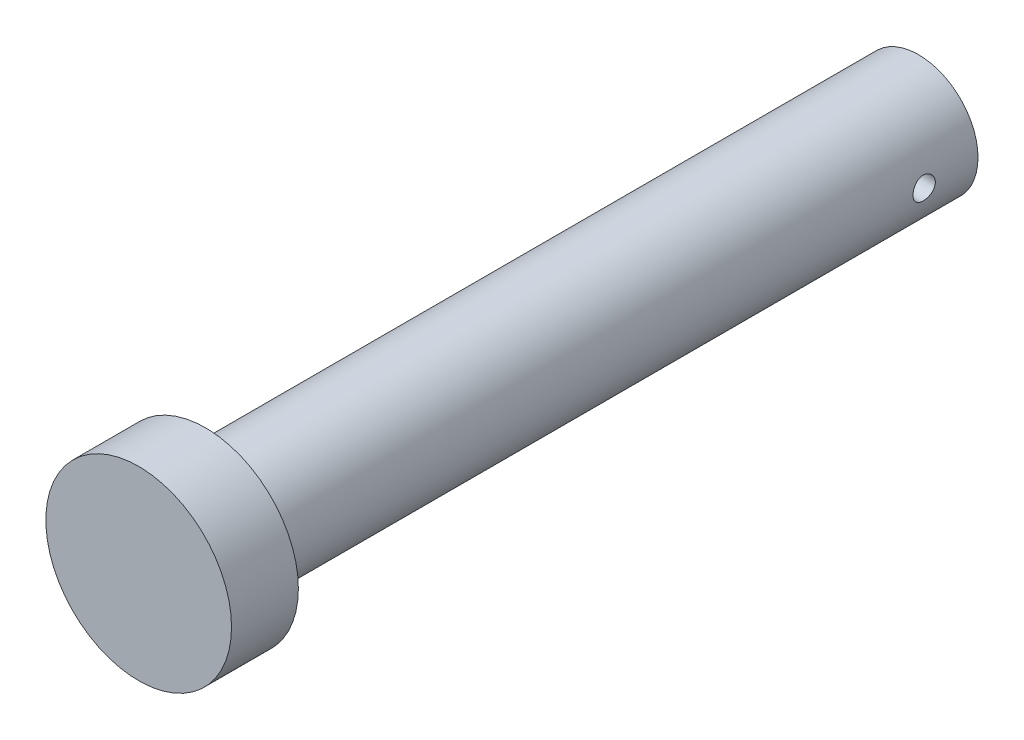
from build123d import *

# Parameters (mm, degrees)
SKETCH1_R           = 12.5
BOSS_EXTRUDE1_DEPTH = 9
SKETCH2_R           = 8
BOSS_EXTRUDE3_DEPTH = 96
SKETCH3_R           = 1.5
CUT_EXTRUDE1_DEPTH  = 48


with BuildPart() as part:
    # Sketch1 → Boss-Extrude1 (new body)
    with BuildSketch(Plane.XY):
        Circle(SKETCH1_R)
    extrude(amount=BOSS_EXTRUDE1_DEPTH)

    # Sketch2 → Boss-Extrude3 (add)
    with BuildSketch(Plane.XY):
        Circle(SKETCH2_R)
    extrude(amount=-BOSS_EXTRUDE3_DEPTH)

    # Sketch3 → Cut-Extrude1 (cut, symmetric)
    with BuildSketch(Plane(origin=(0, 0, 0), x_dir=(0, 0, -1), z_dir=(1, 0, 0))):
        with Locations((88.755218698, 0)):
            Circle(SKETCH3_R)
    extrude(amount=CUT_EXTRUDE1_DEPTH, both=True, mode=Mode.SUBTRACT)


solid = part.part
